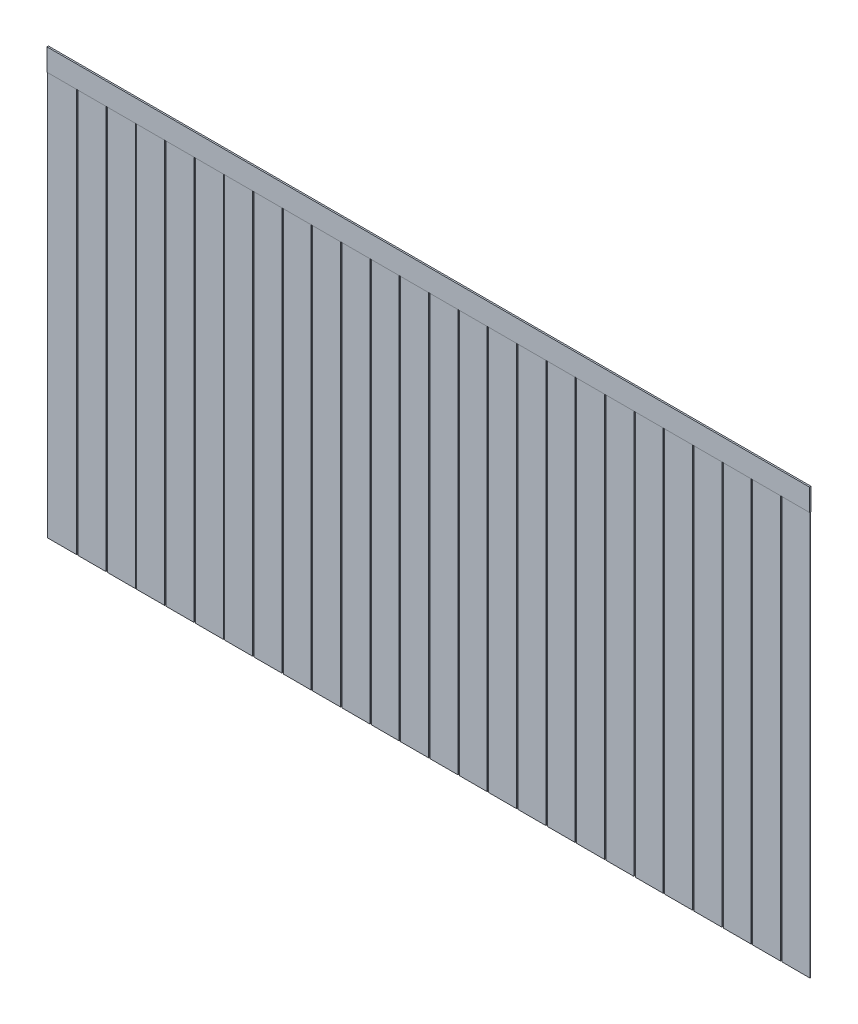
from build123d import *

# Parameters (mm, degrees)
CROQUIS1_W              = 5200
CROQUIS1_H              = 2900
SALIENTE_EXTRUIR1_DEPTH = 10
CROQUIS2_W              = 10
CROQUIS2_H              = 2750
CORTAR_EXTRUIR1_DEPTH   = 10
MATRIZL1_COUNT          = 25
MATRIZL1_PITCH          = 200
CROQUIS4_W              = 5200
CROQUIS4_H              = 2750
CORTAR_EXTRUIR2_DEPTH   = 2
CROQUIS5_W              = 5200
CROQUIS5_H              = 2750
CORTAR_EXTRUIR3_DEPTH   = 2


with BuildPart() as part:
    # Croquis1 → Saliente-Extruir1 (new body)
    with BuildSketch(Plane.XY):
        with Locations((2600, -1450)):
            Rectangle(CROQUIS1_W, CROQUIS1_H)
    extrude(amount=SALIENTE_EXTRUIR1_DEPTH)

    # Croquis2 → Cortar-Extruir1 (cut)
    with BuildSketch(Plane.XY.offset(10)):
        with Locations((205, -1525)):
            Rectangle(CROQUIS2_W, CROQUIS2_H)
    cortar_extruir1 = extrude(amount=-CORTAR_EXTRUIR1_DEPTH, mode=Mode.SUBTRACT)

    # MatrizL1: Cortar-Extruir1 ×25
    with Locations(*[(i * MATRIZL1_PITCH, 0, 0) for i in range(1, MATRIZL1_COUNT)]):
        add(cortar_extruir1, mode=Mode.SUBTRACT)

    # Croquis4 → Cortar-Extruir2 (cut)
    with BuildSketch(Plane.XY.offset(10)):
        with Locations((2600, -1525)):
            Rectangle(CROQUIS4_W, CROQUIS4_H)
    extrude(amount=-CORTAR_EXTRUIR2_DEPTH, mode=Mode.SUBTRACT)

    # Croquis5 → Cortar-Extruir3 (cut)
    with BuildSketch(Plane(origin=(0, 0, 0), x_dir=(-1, 0, 0), z_dir=(0, 0, -1))):
        with Locations((-2600, -1525)):
            Rectangle(CROQUIS5_W, CROQUIS5_H)
    extrude(amount=-CORTAR_EXTRUIR3_DEPTH, mode=Mode.SUBTRACT)


solid = part.part
